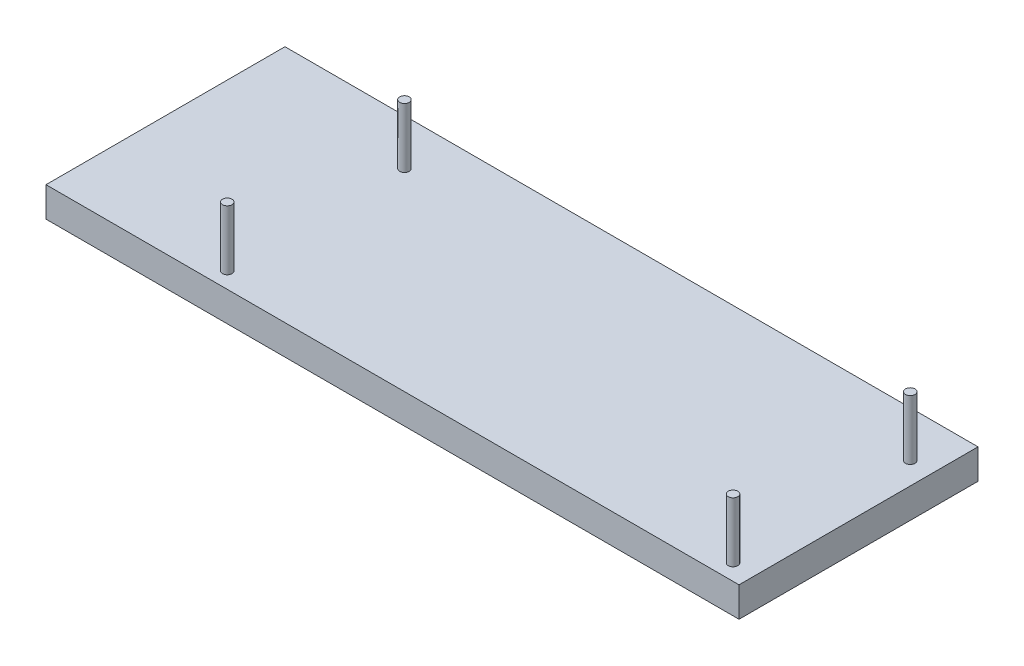
from build123d import *

# Parameters (mm, degrees)
SKETCH2_W           = 116
SKETCH2_H           = 40
BOSS_EXTRUDE1_DEPTH = 5
SKETCH3_R           = 0.8
BOSS_EXTRUDE4_DEPTH = 10


with BuildPart() as part:
    # Sketch2 → Boss-Extrude1 (new body)
    with BuildSketch(Plane(origin=(0, 0, 0), x_dir=(1, 0, 0), z_dir=(0, 1, 0))):
        with Locations((0, 20)):
            Rectangle(SKETCH2_W, SKETCH2_H)
    extrude(amount=BOSS_EXTRUDE1_DEPTH)

    # Sketch3 → Boss-Extrude4 (add)
    with BuildSketch(Plane(origin=(0, 5, 0), x_dir=(1, 0, 0), z_dir=(0, 1, 0))):
        with Locations(Location((54.33, 32.33, 0), (0, 0, 270))):
            Circle(SKETCH3_R)
        with Locations(Location((54.33, 2.67, 0), (0, 0, 270))):
            Circle(SKETCH3_R)
        with Locations(Location((-30.33, 2.67, 0), (0, 0, 270))):
            Circle(SKETCH3_R)
        with Locations(Location((-30.33, 32.33, 0), (0, 0, 270))):
            Circle(SKETCH3_R)
    extrude(amount=BOSS_EXTRUDE4_DEPTH)


solid = part.part
